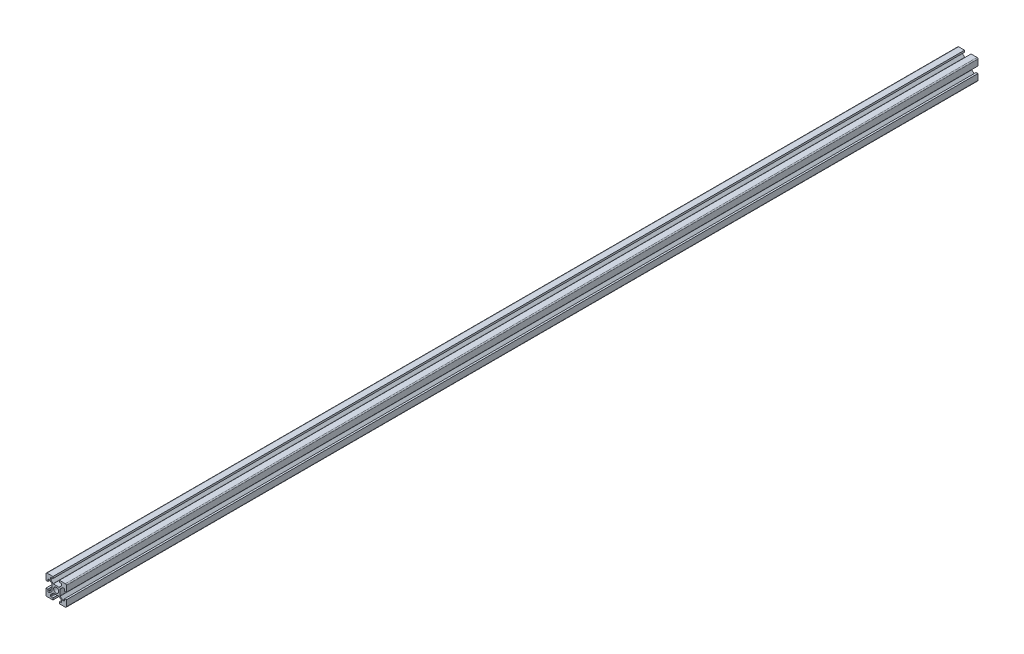
from build123d import *

# Parameters (mm, degrees)
SKETCH1_R           = 2.5
BOSS_EXTRUDE1_DEPTH = 894.4
FILLET1_R           = 1
FILLET2_R           = 0.5
FILLET3_R           = 0.5
FILLET4_R           = 0.5
FILLET5_R           = 0.5


with BuildPart() as part:
    # Sketch1 → Boss-Extrude1 (new body)
    with BuildSketch(Plane.XY):
        Polygon((13.2, 0), (13.2, 1.8), (15.45, 1.8), (15.45, 3.6), (12.95, 6.1), (7.05, 6.1), (4.55, 3.6), (4.55, 1.8), (6.8, 1.8), (6.8, 0), (0, 0), (0, 6.8), (1.8, 6.8), (1.8, 4.55), (3.6, 4.55), (6.1, 7.05), (6.1, 12.95), (3.6, 15.45), (1.8, 15.45), (1.8, 13.2), (0, 13.2), (0, 20), (6.8, 20), (6.8, 18.2), (4.55, 18.2), (4.55, 16.4), (7.05, 13.9), (12.95, 13.9), (15.45, 16.4), (15.45, 18.2), (13.2, 18.2), (13.2, 20), (20, 20), (20, 13.2), (18.2, 13.2), (18.2, 15.45), (16.4, 15.45), (13.9, 12.95), (13.9, 7.05), (16.4, 4.55), (18.2, 4.55), (18.2, 6.8), (20, 6.8), (20, 0), align=None)
        with Locations((10, 10)):
            Circle(SKETCH1_R, mode=Mode.SUBTRACT)
    extrude(amount=BOSS_EXTRUDE1_DEPTH)

    # Fillet1
    fillet1_edges = [part.edges().sort_by_distance(p)[0] for p in [
        (0, 0, 447.2),
        (0, 20, 447.2),
        (20, 20, 447.2),
        (20, 0, 447.2),
    ]]
    fillet(fillet1_edges, radius=FILLET1_R)

    # Fillet2
    fillet2_edges = [part.edges().sort_by_distance(p)[0] for p in [
        (4.55, 18.2, 447.2),
        (4.55, 16.4, 447.2),
        (7.05, 13.9, 447.2),
        (12.95, 13.9, 447.2),
        (15.45, 16.4, 447.2),
        (15.45, 18.2, 447.2),
    ]]
    fillet(fillet2_edges, radius=FILLET2_R)

    # Fillet3
    fillet3_edges = [part.edges().sort_by_distance(p)[0] for p in [
        (18.2, 15.45, 447.2),
        (16.4, 15.45, 447.2),
        (13.9, 12.95, 447.2),
        (13.9, 7.05, 447.2),
        (16.4, 4.55, 447.2),
        (18.2, 4.55, 447.2),
    ]]
    fillet(fillet3_edges, radius=FILLET3_R)

    # Fillet4
    fillet4_edges = [part.edges().sort_by_distance(p)[0] for p in [
        (1.8, 4.55, 447.2),
        (3.6, 4.55, 447.2),
        (6.1, 7.05, 447.2),
        (6.1, 12.95, 447.2),
        (3.6, 15.45, 447.2),
        (1.8, 15.45, 447.2),
    ]]
    fillet(fillet4_edges, radius=FILLET4_R)

    # Fillet5
    fillet5_edges = [part.edges().sort_by_distance(p)[0] for p in [
        (15.45, 1.8, 447.2),
        (15.45, 3.6, 447.2),
        (12.95, 6.1, 447.2),
        (7.05, 6.1, 447.2),
        (4.55, 3.6, 447.2),
        (4.55, 1.8, 447.2),
    ]]
    fillet(fillet5_edges, radius=FILLET5_R)


solid = part.part
